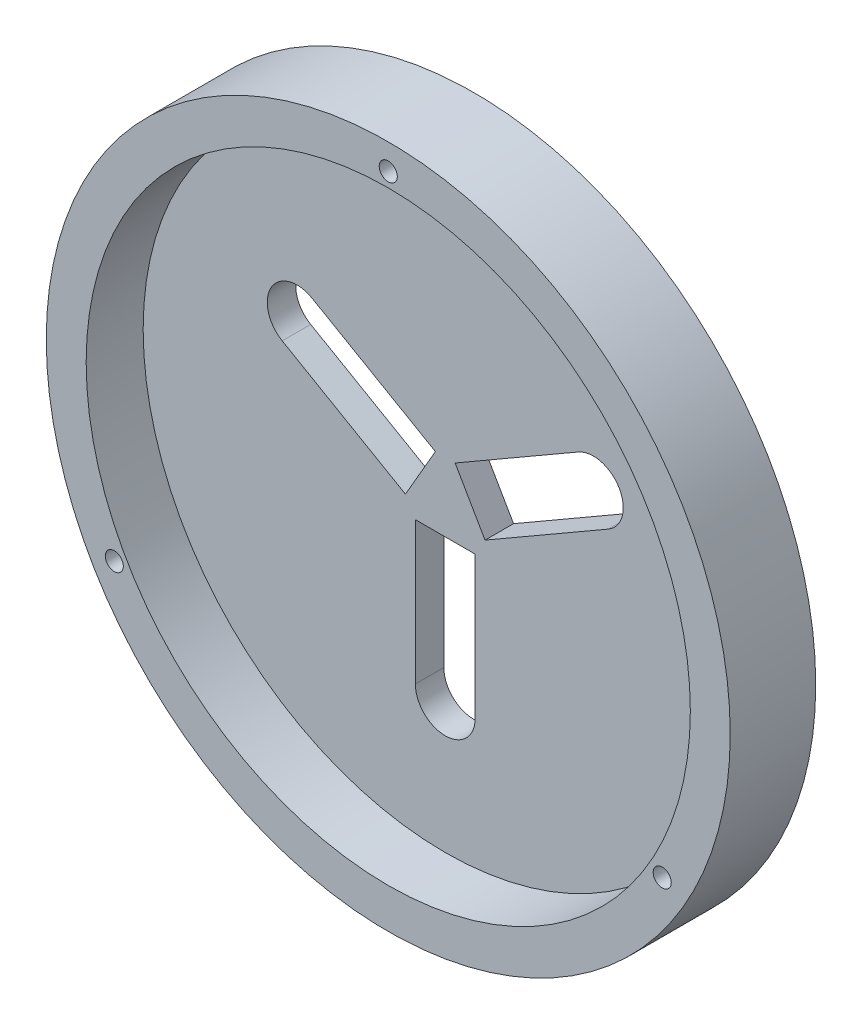
from build123d import *

# Parameters (mm, degrees)
CROQUIS1_R                   = 55
DISCO_DEPTH                  = 5
CORTAR_EXTRUIR1_DEPTH        = 10
SALIENTE_EXTRUIR1_DEPTH      = 10
SALIENTE_EXTRUIR1_DEPTH_BACK = 5
CROQUIS7_R                   = 60
CROQUIS7_R_2                 = 55
CROQUIS7_R_3                 = 53
SALIENTE_EXTRUIR6_DEPTH      = 5
CROQUIS9_R                   = 1.5875
CORTAR_EXTRUIR2_DEPTH        = 87.168439698
CROQUIS10_R                  = 3
CORTAR_EXTRUIR3_DEPTH        = 3


with BuildPart() as part:
    # Croquis1 → Disco (new body)
    with BuildSketch(Plane.XY):
        Circle(CROQUIS1_R)
    extrude(amount=DISCO_DEPTH)

    # Croquis6 → Cortar-Extruir1 (cut)
    with BuildSketch(Plane.XY.offset(5)):
        with BuildLine():
            Line((-5.25, 0), (-5.25, -30))
            ThreePointArc((-5.25, -30), (0, -35.25), (5.25, -30))
            Line((5.25, -30), (5.25, 0))
            ThreePointArc((5.25, 0), (0, 5.25), (-5.25, 0))
        make_face()
        with BuildLine():
            Line((2.625, 4.54663337), (-23.355762114, 19.54663337))
            ThreePointArc((-23.355762114, 19.54663337), (-30.527395483, 17.625), (-28.605762114, 10.45336663))
            Line((-28.605762114, 10.45336663), (-2.625, -4.54663337))
            ThreePointArc((-2.625, -4.54663337), (4.54663337, -2.625), (2.625, 4.54663337))
        make_face()
        with BuildLine():
            Line((2.625, -4.54663337), (28.605762114, 10.45336663))
            ThreePointArc((28.605762114, 10.45336663), (30.527395483, 17.625), (23.355762114, 19.54663337))
            Line((23.355762114, 19.54663337), (-2.625, 4.54663337))
            ThreePointArc((-2.625, 4.54663337), (-4.54663337, -2.625), (2.625, -4.54663337))
        make_face()
    extrude(amount=-CORTAR_EXTRUIR1_DEPTH, mode=Mode.SUBTRACT)

    # Croquis7 → Saliente-Extruir1 (add, two sides: drawn at the far end of the back side and taken through both)
    # profile 1 of 2: a face of its own
    with BuildSketch(Plane.XY.offset(5).offset(-SALIENTE_EXTRUIR1_DEPTH_BACK)):
        Circle(CROQUIS7_R)
        Circle(CROQUIS7_R_2, mode=Mode.SUBTRACT)
    # profile 2 of 2: a face of its own
    with BuildSketch(Plane.XY.offset(5).offset(-SALIENTE_EXTRUIR1_DEPTH_BACK)):
        Circle(CROQUIS7_R_2)
        Circle(CROQUIS7_R_3, mode=Mode.SUBTRACT)
    extrude(amount=SALIENTE_EXTRUIR1_DEPTH + SALIENTE_EXTRUIR1_DEPTH_BACK)

    # Croquis8 → Saliente-Extruir6 (add)
    with BuildSketch(Plane.XY.offset(5)):
        Polygon((-8.714101615, -5.031088913), (0, 10.062177826), (8.714101615, -5.031088913), align=None)
    extrude(amount=-SALIENTE_EXTRUIR6_DEPTH)

    # Croquis9 → Cortar-Extruir2 (cut, through all)
    with BuildSketch(Plane.XY.offset(15)):
        with Locations((0, 55.5)):
            Circle(CROQUIS9_R)
        with Locations((48.06440991, -27.75)):
            Circle(CROQUIS9_R)
        with Locations((-48.06440991, -27.75)):
            Circle(CROQUIS9_R)
    extrude(amount=-CORTAR_EXTRUIR2_DEPTH, mode=Mode.SUBTRACT)

    # Croquis10 → Cortar-Extruir3 (cut)
    with BuildSketch(Plane(origin=(0, 0, 0), x_dir=(-1, 0, 0), z_dir=(0, 0, -1))):
        with Locations((0, 55.5)):
            Circle(CROQUIS10_R)
        with Locations((48.06440991, -27.75)):
            Circle(CROQUIS10_R)
        with Locations((-48.06440991, -27.75)):
            Circle(CROQUIS10_R)
    extrude(amount=-CORTAR_EXTRUIR3_DEPTH, mode=Mode.SUBTRACT)


solid = part.part
